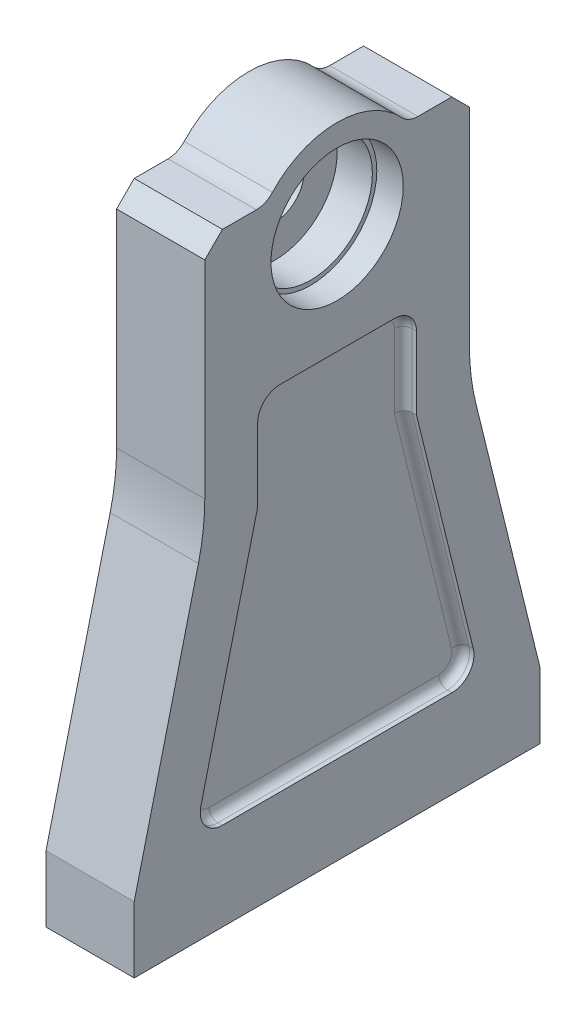
from build123d import *

# Parameters (mm, degrees)
BOSS_EXTRUDE1_DEPTH  = 10
CUT_EXTRUDE1_DEPTH   = 3
FILLET1_R            = 2
FILLET1_OF_MIRROR1_R = 2
SKETCH3_R            = 15
SKETCH3_R_2          = 14
CUT_EXTRUDE2_DEPTH   = 6
SKETCH3_3_R          = 14
CUT_EXTRUDE3_DEPTH   = 14
SKETCH3_4_R          = 6.5
CUT_EXTRUDE4_DEPTH   = 154.430766146
SKETCH4_R            = 5
CUT_EXTRUDE5_DEPTH   = 20
FILLET2_R            = 5


with BuildPart() as part:
    # Sketch1 → Boss-Extrude1 (new, symmetric)
    with BuildSketch(Plane(origin=(0, 0, 0), x_dir=(0, 0, -1), z_dir=(1, 0, 0))):
        with BuildLine():
            Line((-16, 137), (-26, 137))
            Line((-26, 137), (-30, 133))
            Line((-30, 133), (-30, 86.06334964))
            ThreePointArc((-30, 86.06334964), (-30.363636327, 80.044097084), (-31.449256053, 74.112397284))
            Line((-31.449256053, 74.112397284), (-46, 15))
            Line((-46, 15), (-46, 0))
            Line((-46, 0), (46, 0))
            Line((46, 0), (46, 15))
            Line((46, 15), (31.449256053, 74.112397284))
            ThreePointArc((31.449256053, 74.112397284), (30.363636327, 80.044097084), (30, 86.06334964))
            Line((30, 86.06334964), (30, 133))
            Line((30, 133), (26, 137))
            Line((26, 137), (16, 137))
            ThreePointArc((16, 137), (0, 145), (-16, 137))
        make_face()
    extrude(amount=BOSS_EXTRUDE1_DEPTH, both=True)

    # Sketch2 → Cut-Extrude1 (cut)
    with BuildSketch(Plane(origin=(10, 0, 0), x_dir=(0, 0, -1), z_dir=(1, 0, 0))):
        with BuildLine():
            Line((13, 100), (-13, 100))
            ThreePointArc((-13, 100), (-16.535533906, 98.535533906), (-18, 95))
            Line((-18, 95), (-18, 78.544796086))
            Line((-18, 78.544796086), (-30.886080209, 26.195095236))
            ThreePointArc((-30.886080209, 26.195095236), (-29.966452179, 21.915804495), (-26.031005815, 20))
            Line((-26.031005815, 20), (26.031005815, 20))
            ThreePointArc((26.031005815, 20), (29.966452179, 21.915804495), (30.886080209, 26.195095236))
            Line((30.886080209, 26.195095236), (18, 78.544796086))
            Line((18, 78.544796086), (18, 95))
            ThreePointArc((18, 95), (16.535533906, 98.535533906), (13, 100))
        make_face()
    cut_extrude1 = extrude(amount=-CUT_EXTRUDE1_DEPTH, mode=Mode.SUBTRACT)

    # Fillet1
    fillet1_edges = [part.edges().sort_by_distance(p)[0] for p in [
        (7, 86.772398043, 18),
        (7, 98.535533906, 16.535533906),
        (7, 100, 0),
        (7, 98.535533906, -16.535533906),
        (7, 86.772398043, -18),
        (7, 52.369945661, -24.443040105),
        (7, 21.915804495, -29.966452179),
        (7, 20, 0),
        (7, 21.915804495, 29.966452179),
        (7, 52.369945661, 24.443040105),
    ]]
    fillet(fillet1_edges, radius=FILLET1_R)

    # Mirror1: Cut-Extrude1 across plane
    add(cut_extrude1.mirror(Plane(origin=(0, 0, 0), x_dir=(0, 0, 1), z_dir=(1, 0, 0))), mode=Mode.SUBTRACT)

    # Fillet1 of Mirror1
    fillet1_of_mirror1_edges = [part.edges().sort_by_distance(p)[0] for p in [
        (-7, 86.772398043, 18),
        (-7, 98.535533906, 16.535533906),
        (-7, 100, 0),
        (-7, 98.535533906, -16.535533906),
        (-7, 86.772398043, -18),
        (-7, 52.369945661, -24.443040105),
        (-7, 21.915804495, -29.966452179),
        (-7, 20, 0),
        (-7, 21.915804495, 29.966452179),
        (-7, 52.369945661, 24.443040105),
    ]]
    fillet(fillet1_of_mirror1_edges, radius=FILLET1_OF_MIRROR1_R)

    # Sketch3 → Cut-Extrude2 (cut)
    with BuildSketch(Plane(origin=(10, 0, 0), x_dir=(0, 0, -1), z_dir=(1, 0, 0))):
        with Locations((0, 125)):
            Circle(SKETCH3_R)
        with Locations((0, 125)):
            Circle(SKETCH3_R_2, mode=Mode.SUBTRACT)
    extrude(amount=-CUT_EXTRUDE2_DEPTH, mode=Mode.SUBTRACT)

    # Sketch3<3> → Cut-Extrude3 (cut)
    with BuildSketch(Plane(origin=(10, 0, 0), x_dir=(0, 0, -1), z_dir=(1, 0, 0))):
        with Locations((0, 125)):
            Circle(SKETCH3_3_R)
    extrude(amount=-CUT_EXTRUDE3_DEPTH, mode=Mode.SUBTRACT)

    # Sketch3<4> → Cut-Extrude4 (cut, through all)
    with BuildSketch(Plane(origin=(10, 0, 0), x_dir=(0, 0, -1), z_dir=(1, 0, 0))):
        with Locations((0, 125)):
            Circle(SKETCH3_4_R)
    extrude(amount=-CUT_EXTRUDE4_DEPTH, mode=Mode.SUBTRACT)

    # Sketch4 → Cut-Extrude5 (cut)
    with BuildSketch(Plane.XZ):
        with Locations((0, 30)):
            Circle(SKETCH4_R)
        with Locations((0, -30)):
            Circle(SKETCH4_R)
    extrude(amount=-CUT_EXTRUDE5_DEPTH, mode=Mode.SUBTRACT)

    # Fillet2
    fillet2_edges = [part.edges().sort_by_distance(p)[0] for p in [
        (0, 137, -16),
        (0, 137, 16),
    ]]
    fillet(fillet2_edges, radius=FILLET2_R)


solid = part.part
